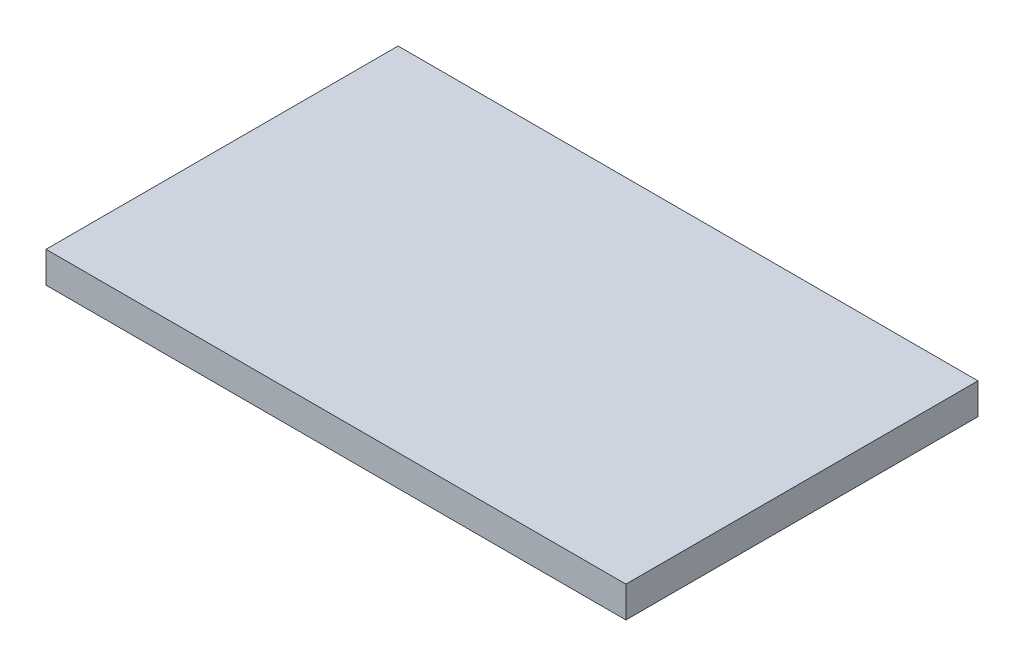
from build123d import *

# Parameters (mm, degrees)
SKETCH1_W           = 168
SKETCH1_H           = 9
BOSS_EXTRUDE1_DEPTH = 102


with BuildPart() as part:
    # Sketch1 → Boss-Extrude1 (new body)
    with BuildSketch(Plane.XY):
        Rectangle(SKETCH1_W, SKETCH1_H)
    extrude(amount=BOSS_EXTRUDE1_DEPTH)


solid = part.part
